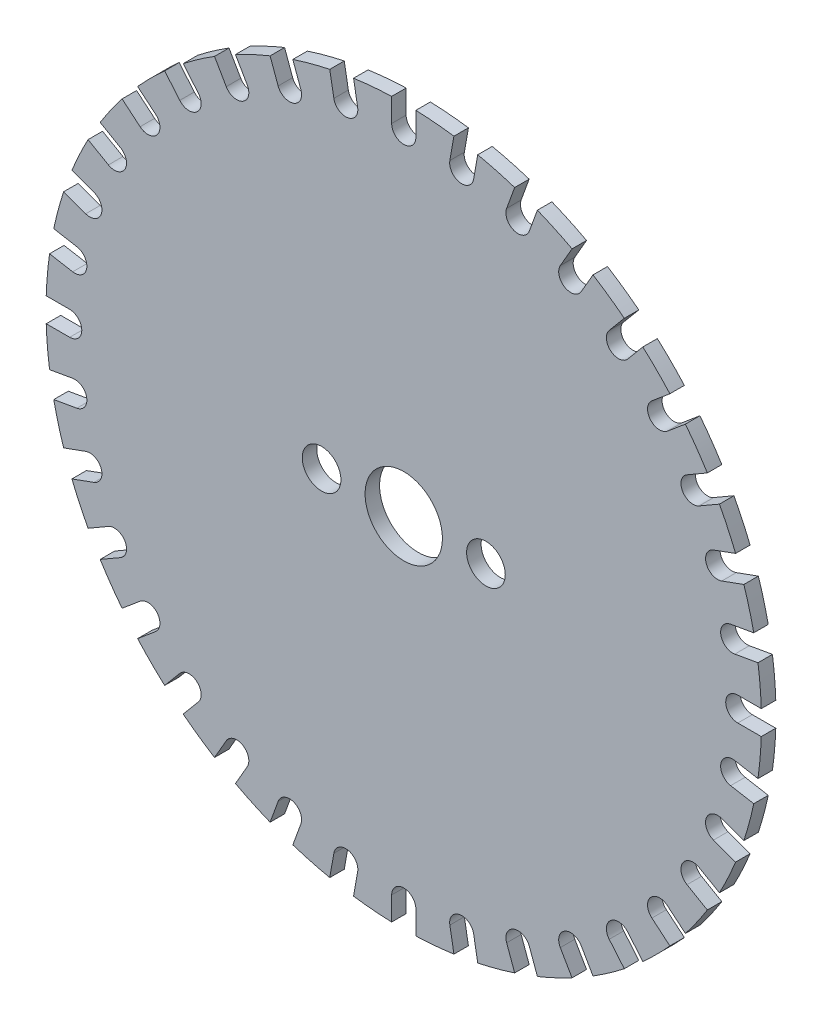
from build123d import *

# Parameters (mm, degrees)
ESQUISSE1_R                  = 37
ESQUISSE1_R_2                = 4
ESQUISSE1_R_3                = 2
BOSS_EXTRU_1_DEPTH           = 1.5
ENL_V_MAT_EXTRU_1_DEPTH      = 53.347397261
R_P_TITION_CIRCULAIRE1_COUNT = 36


with BuildPart() as part:
    # Esquisse1 → Boss.-Extru.1 (new body)
    with BuildSketch(Plane.XY):
        Circle(ESQUISSE1_R)
        Circle(ESQUISSE1_R_2, mode=Mode.SUBTRACT)
        with Locations((8.5, 0)):
            Circle(ESQUISSE1_R_3, mode=Mode.SUBTRACT)
        with Locations((-8.5, 0)):
            Circle(ESQUISSE1_R_3, mode=Mode.SUBTRACT)
    extrude(amount=BOSS_EXTRU_1_DEPTH)

    # Esquisse2 → Enlèv. mat.-Extru.1 (cut, through all)
    with BuildSketch(Plane.XY.offset(1.5)):
        with BuildLine():
            Line((-40.577200577, 1.25), (-34.55, 1.25))
            ThreePointArc((-34.55, 1.25), (-33.3, 0), (-34.55, -1.25))
            Line((-34.55, -1.25), (-40.577200577, -1.25))
            ThreePointArc((-40.577200577, -1.25), (-41.827200577, 0), (-40.577200577, 1.25))
        make_face()
    enl_v_mat_extru_1 = extrude(amount=-ENL_V_MAT_EXTRU_1_DEPTH, mode=Mode.SUBTRACT)

    # Répétition circulaire1: Enlèv. mat.-Extru.1 ×36 about axis
    r_p_tition_circulaire1_axis = Axis((0, 0, 0), (0, 0, 1))
    for i in range(1, R_P_TITION_CIRCULAIRE1_COUNT):
        add(enl_v_mat_extru_1.rotate(r_p_tition_circulaire1_axis, i * 360 / R_P_TITION_CIRCULAIRE1_COUNT), mode=Mode.SUBTRACT)


solid = part.part
